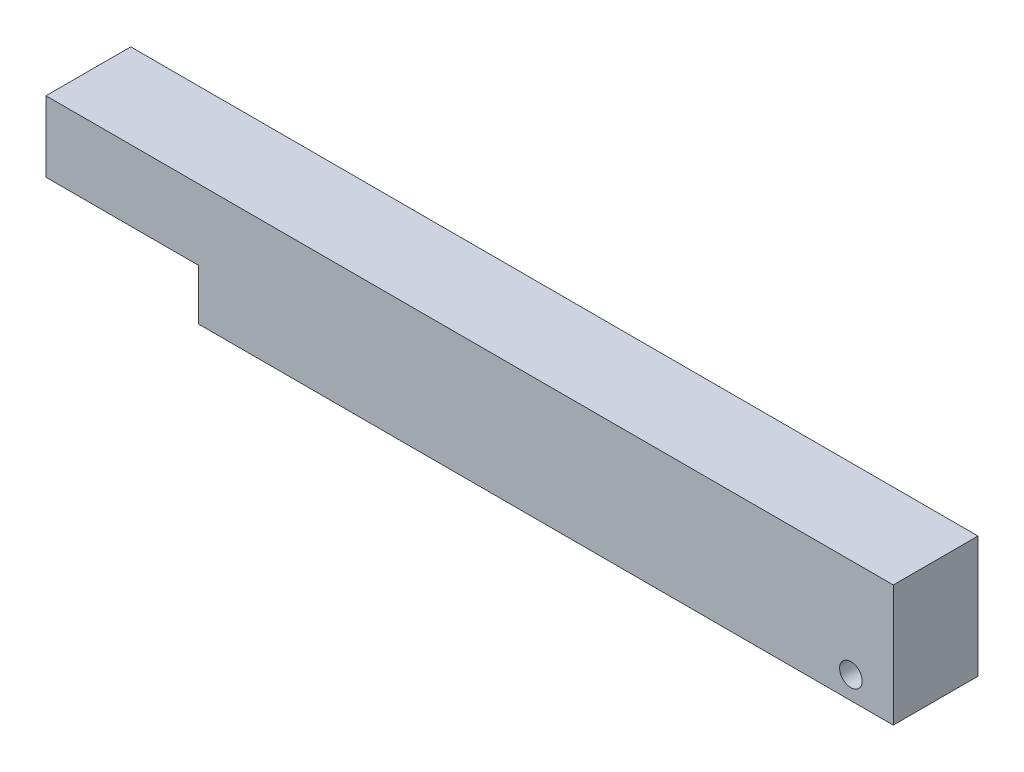
from build123d import *

# Parameters (mm, degrees)
ESQUISSE1_W                  = 300
ESQUISSE1_H                  = 25
BOSS_EXTRU_1_DEPTH           = 30
ESQUISSE3_W                  = 246
ESQUISSE3_H                  = 18
BOSS_EXTRU_2_DEPTH           = 30
ENL_V_MAT_EXTRU_1_DEPTH      = 303.530990148
ENL_V_MAT_EXTRU_1_DEPTH_BACK = 303.530990148
ESQUISSE2_R                  = 4


with BuildPart() as part:
    # Esquisse1 → Boss.-Extru.1 (new body)
    with BuildSketch(Plane.XY):
        with Locations((150, 12.5)):
            Rectangle(ESQUISSE1_W, ESQUISSE1_H)
    extrude(amount=BOSS_EXTRU_1_DEPTH)

    # Esquisse3 → Boss.-Extru.2 (add)
    with BuildSketch(Plane.XY.offset(30)):
        with Locations((177, -9)):
            Rectangle(ESQUISSE3_W, ESQUISSE3_H)
    extrude(amount=-BOSS_EXTRU_2_DEPTH)

    # Esquisse2 → Enlèv. mat.-Extru.1 (cut, two sides: drawn at the far end of the back side and taken through both)
    with BuildSketch(Plane.XY.offset(30).offset(-ENL_V_MAT_EXTRU_1_DEPTH_BACK)):
        with Locations((285, -10)):
            Circle(ESQUISSE2_R)
    extrude(amount=ENL_V_MAT_EXTRU_1_DEPTH + ENL_V_MAT_EXTRU_1_DEPTH_BACK, mode=Mode.SUBTRACT)


solid = part.part
